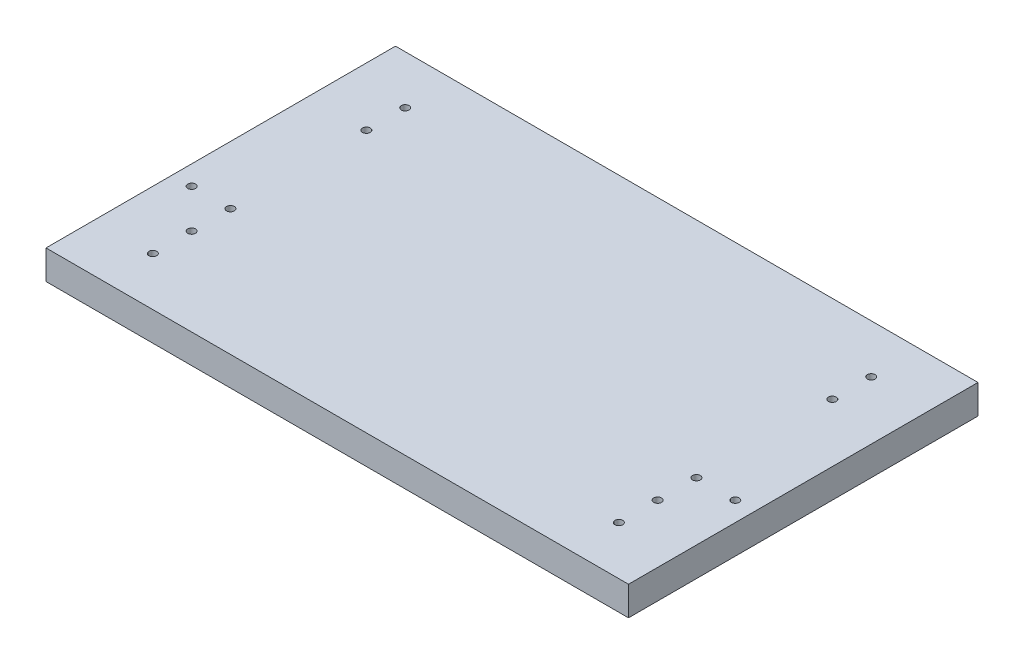
from build123d import *

# Parameters (mm, degrees)
CROQUIS1_W              = 300
CROQUIS1_H              = 180
SALIENTE_EXTRUIR1_DEPTH = 15
CROQUIS2_R              = 2
CORTAR_EXTRUIR1_DEPTH   = 10


with BuildPart() as part:
    # Croquis1 → Saliente-Extruir1 (new body)
    with BuildSketch(Plane(origin=(0, 0, 0), x_dir=(1, 0, 0), z_dir=(0, 1, 0))):
        Rectangle(CROQUIS1_W, CROQUIS1_H)
    extrude(amount=SALIENTE_EXTRUIR1_DEPTH)

    # Croquis2 → Cortar-Extruir1 (cut)
    with BuildSketch(Plane(origin=(0, 15, 0), x_dir=(1, 0, 0), z_dir=(0, 1, 0))):
        with Locations(Location((-120, -65, 0), (0, 0, 270))):
            Circle(CROQUIS2_R)
        with Locations(Location((-120, -45, 0), (0, 0, 270))):
            Circle(CROQUIS2_R)
        with Locations(Location((120, -65, 0), (0, 0, 270))):
            Circle(CROQUIS2_R)
        with Locations(Location((120, -45, 0), (0, 0, 270))):
            Circle(CROQUIS2_R)
        with Locations(Location((-140, -25, 0), (0, 0, 270))):
            Circle(CROQUIS2_R)
        with Locations(Location((-120, -25, 0), (0, 0, 270))):
            Circle(CROQUIS2_R)
        with Locations(Location((120, -25, 0), (0, 0, 270))):
            Circle(CROQUIS2_R)
        with Locations(Location((140, -25, 0), (0, 0, 270))):
            Circle(CROQUIS2_R)
        with Locations(Location((-120, 65, 0), (0, 0, 270))):
            Circle(CROQUIS2_R)
        with Locations(Location((-120, 45, 0), (0, 0, 270))):
            Circle(CROQUIS2_R)
        with Locations(Location((120, 45, 0), (0, 0, 270))):
            Circle(CROQUIS2_R)
        with Locations(Location((120, 65, 0), (0, 0, 270))):
            Circle(CROQUIS2_R)
    extrude(amount=-CORTAR_EXTRUIR1_DEPTH, mode=Mode.SUBTRACT)


solid = part.part
